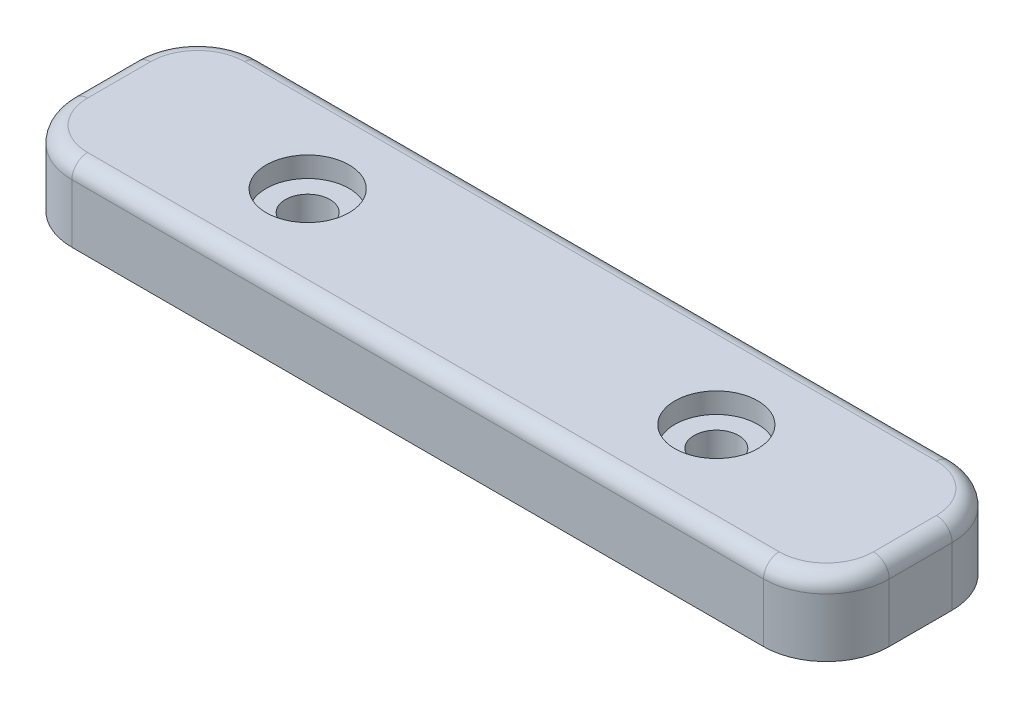
from build123d import *

# Parameters (mm, degrees)
SKETCH1_W                       = 66.04
SKETCH1_H                       = 15.24
BOSS_EXTRUDE1_DEPTH             = 6
CBORE_FOR_M3_SBHCS1_D           = 3.6
CBORE_FOR_M3_SBHCS1_CBORE_D     = 6.7
CBORE_FOR_M3_SBHCS1_CBORE_DEPTH = 1.65
FILLET1_R                       = 5.08
FILLET2_R                       = 1.27


with BuildPart() as part:
    # Sketch1 → Boss-Extrude1 (new body)
    with BuildSketch(Plane(origin=(0, 0, 0), x_dir=(1, 0, 0), z_dir=(0, 1, 0))):
        with Locations((33.02, -7.62)):
            Rectangle(SKETCH1_W, SKETCH1_H)
    extrude(amount=BOSS_EXTRUDE1_DEPTH)

    # CBORE for M3 SBHCS1 (through all)
    with Locations(Plane(origin=(0, 6, 0), x_dir=(1, 0, 0), z_dir=(0, 1, 0))):
        with Locations((16.51, -7.62), (49.53, -7.62)):
            CounterBoreHole(CBORE_FOR_M3_SBHCS1_D / 2, CBORE_FOR_M3_SBHCS1_CBORE_D / 2, CBORE_FOR_M3_SBHCS1_CBORE_DEPTH)

    # Fillet1
    fillet1_edges = [part.edges().sort_by_distance(p)[0] for p in [
        (0, 3, 0),
        (66.04, 3, 0),
        (66.04, 3, 15.24),
        (0, 3, 15.24),
    ]]
    fillet(fillet1_edges, radius=FILLET1_R)

    # Fillet2
    fillet2_edges = [part.edges().sort_by_distance(p)[0] for p in [
        (33.02, 6, 15.24),
        (0, 6, 7.62),
        (66.04, 6, 7.62),
        (33.02, 6, 0),
        (64.552102448, 6, 1.487897552),
        (64.552102448, 6, 13.752102448),
        (1.487897552, 6, 1.487897552),
        (1.487897552, 6, 13.752102448),
    ]]
    fillet(fillet2_edges, radius=FILLET2_R)


solid = part.part
